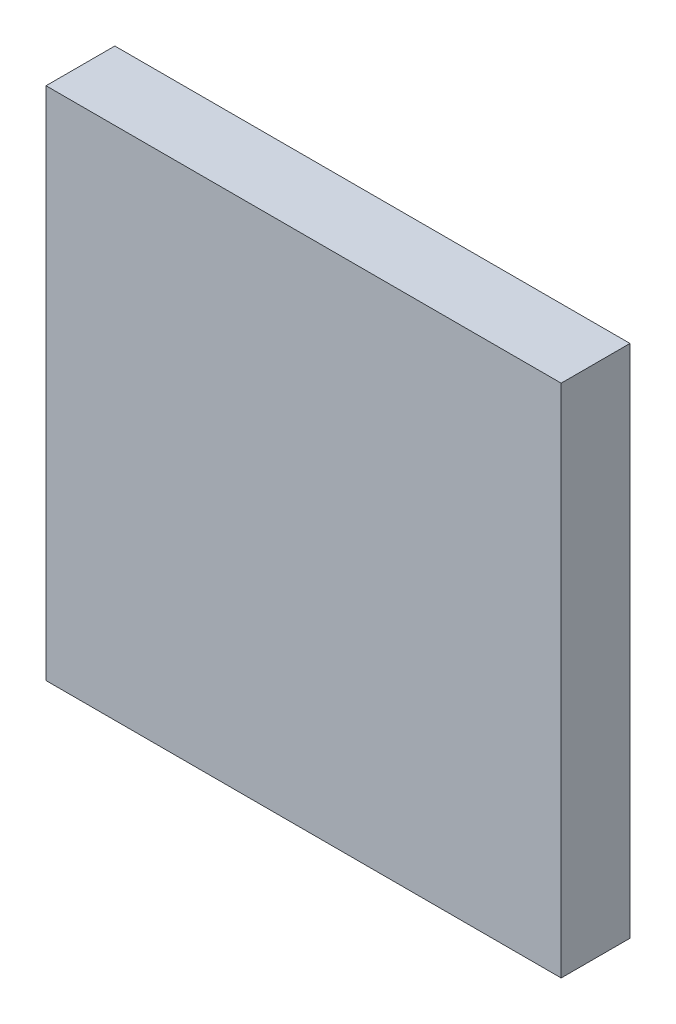
from build123d import *

# Parameters (mm, degrees)
SKETCH1_W           = 224.6
SKETCH1_H           = 224.6
BOSS_EXTRUDE1_DEPTH = 30


with BuildPart() as part:
    # Sketch1 → Boss-Extrude1 (new body)
    with BuildSketch(Plane.XY):
        Rectangle(SKETCH1_W, SKETCH1_H)
    extrude(amount=BOSS_EXTRUDE1_DEPTH)


solid = part.part
